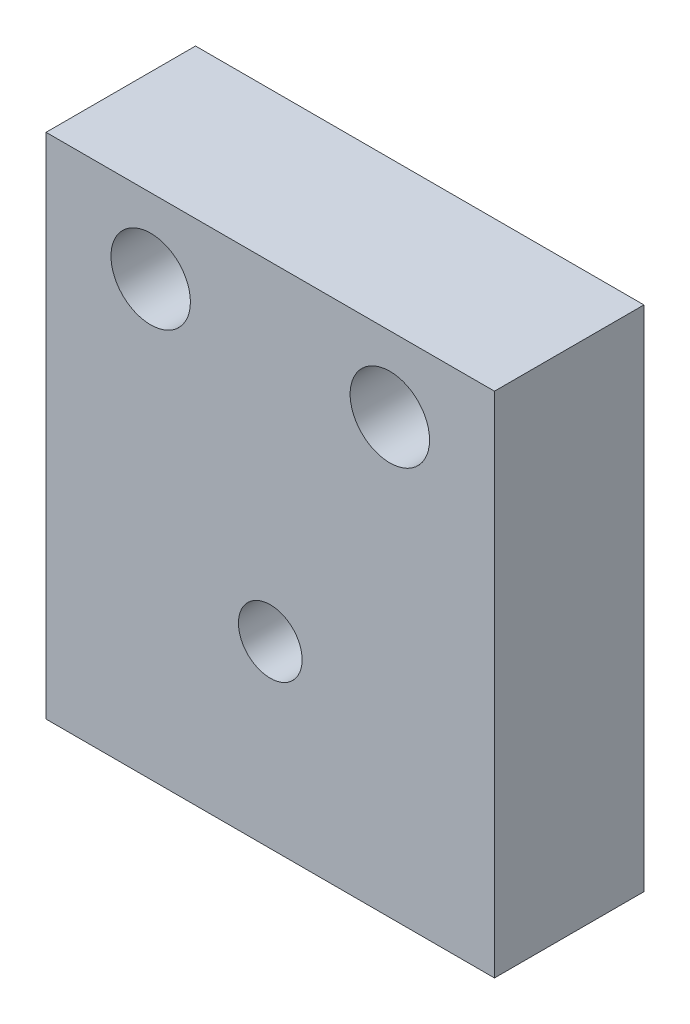
from build123d import *

# Parameters (mm, degrees)
SKETCH1_W                        = 38.1
SKETCH1_H                        = 43.18
BOSS_EXTRUDE1_DEPTH              = 12.7
F_17_64_0_26563_DIAMETER_HOLE1_D = 6.747002
F_1_4_20_TAPPED_HOLE2_D          = 5.1054
F_1_4_20_TAPPED_HOLE2_DEPTH      = 12.7
F_1_4_20_TAPPED_HOLE2_TIP        = 1.533816902
F_1_4_28_TAPPED_HOLE1_D          = 5.4102


with BuildPart() as part:
    # Sketch1 → Boss-Extrude1 (new body)
    with BuildSketch(Plane.XY):
        with Locations((19.05, 21.59)):
            Rectangle(SKETCH1_W, SKETCH1_H)
    extrude(amount=-BOSS_EXTRUDE1_DEPTH)

    # 17/64 (0.26563) Diameter Hole1 (through all)
    with Locations(Plane(origin=(29.21, 36.83, 0), x_dir=(1, 0, 0), z_dir=(0, 0, 1))):
        with Locations((0, 0), (-20.32, 0)):
            Hole(F_17_64_0_26563_DIAMETER_HOLE1_D / 2)

    # 1/4-20 Tapped Hole2
    with Locations(Plane(origin=(0, 27.94, -6.35), x_dir=(0, 0, -1), z_dir=(-1, 0, 0))):
        with Locations((0, 0)):
            Hole(F_1_4_20_TAPPED_HOLE2_D / 2, depth=F_1_4_20_TAPPED_HOLE2_DEPTH)
            with Locations((0, 0, -(F_1_4_20_TAPPED_HOLE2_DEPTH + F_1_4_20_TAPPED_HOLE2_TIP / 2))):  # 118° drill point
                Cone(0, F_1_4_20_TAPPED_HOLE2_D / 2, F_1_4_20_TAPPED_HOLE2_TIP, mode=Mode.SUBTRACT)

    # 1/4-28 Tapped Hole1 (through all)
    with Locations(Plane(origin=(19.05, 15.24, 0), x_dir=(1, 0, 0), z_dir=(0, 0, 1))):
        with Locations((0, 0)):
            Hole(F_1_4_28_TAPPED_HOLE1_D / 2)


solid = part.part
